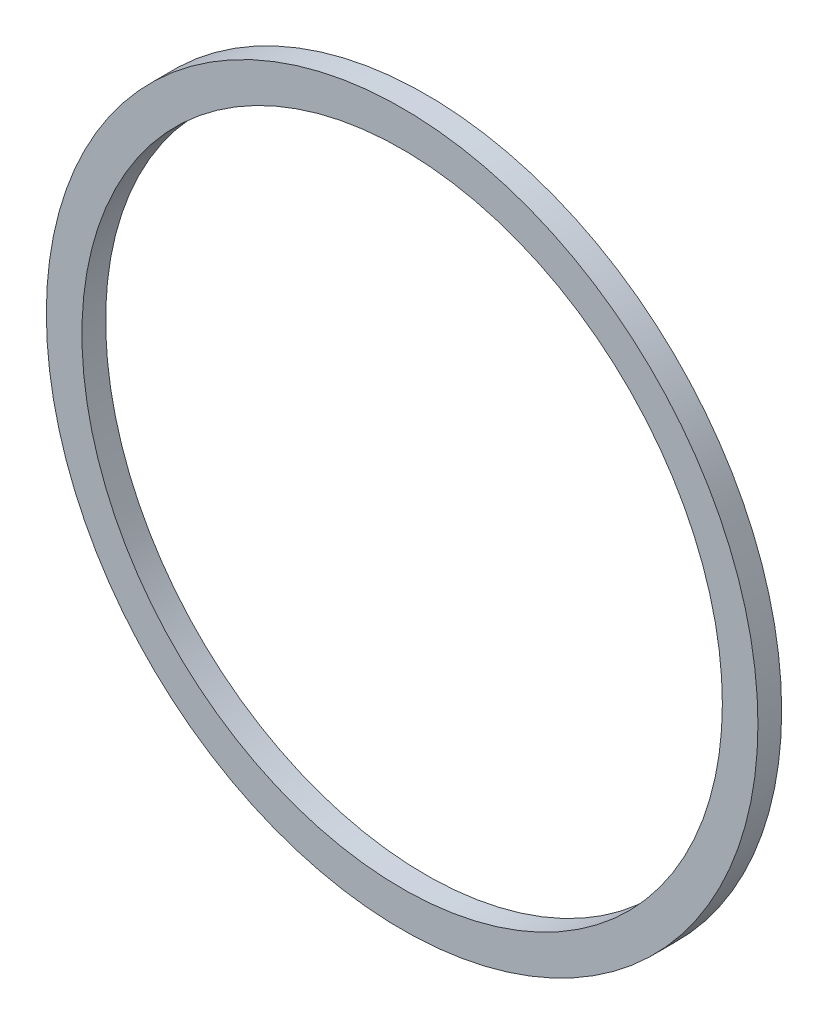
from build123d import *

# Parameters (mm, degrees)
SKETCH1_R           = 75
SKETCH1_R_2         = 67.5
BOSS_EXTRUDE1_DEPTH = 5


with BuildPart() as part:
    # Sketch1 → Boss-Extrude1 (new body)
    with BuildSketch(Plane.XY):
        Circle(SKETCH1_R)
        Circle(SKETCH1_R_2, mode=Mode.SUBTRACT)
    extrude(amount=BOSS_EXTRUDE1_DEPTH)


solid = part.part
